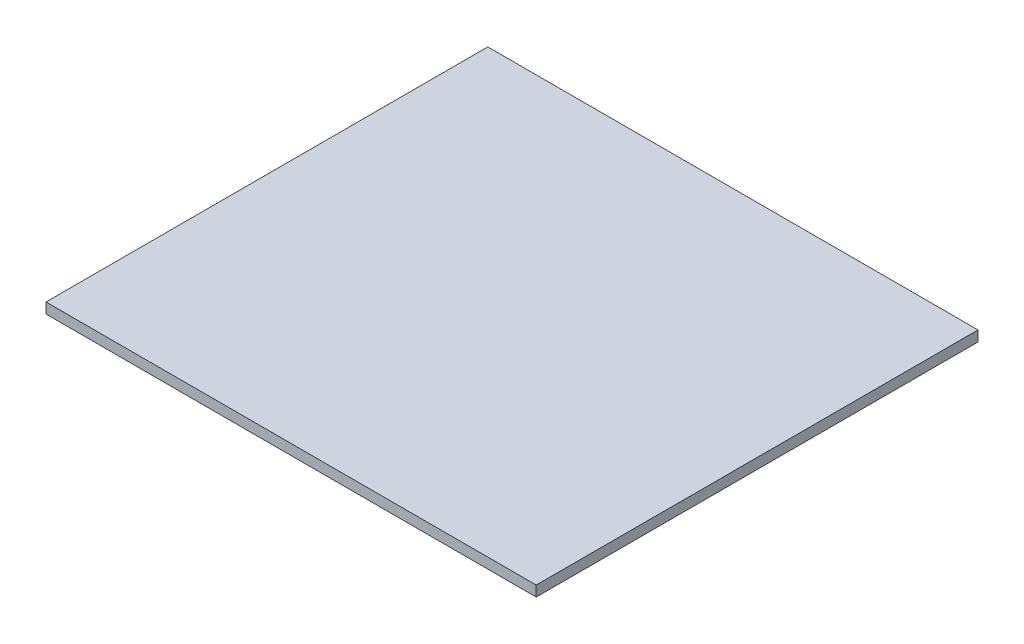
from build123d import *

# Parameters (mm, degrees)
SKETCH1_W           = 82
SKETCH1_H           = 73.9
BOSS_EXTRUDE1_DEPTH = 1.75


with BuildPart() as part:
    # Sketch1 → Boss-Extrude1 (new body)
    with BuildSketch(Plane(origin=(0, 0, 0), x_dir=(1, 0, 0), z_dir=(0, 1, 0))):
        Rectangle(SKETCH1_W, SKETCH1_H)
    extrude(amount=BOSS_EXTRUDE1_DEPTH)


solid = part.part
